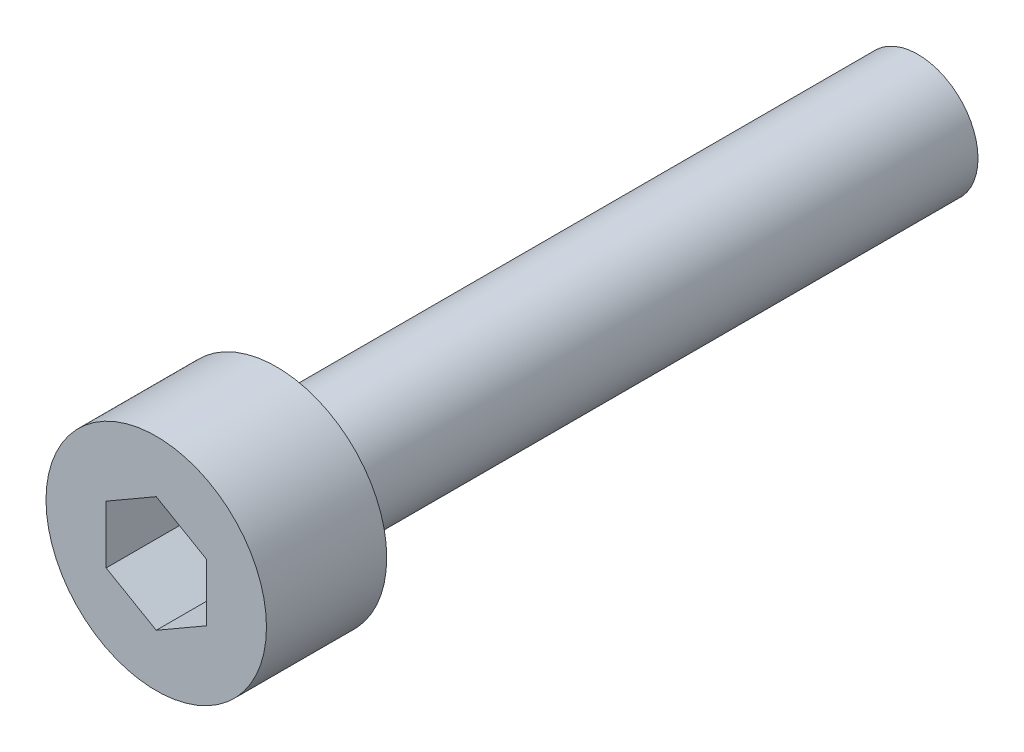
from build123d import *

# Parameters (mm, degrees)
THREAD_ENVELOPE_START = -16
PROFILE_1_R           = 1.5
THREAD_ENVELOPE_DEPTH = 16
PROFILE_2_R           = 2.75
SOCKET_HEAD_DEPTH     = 3


with BuildPart() as part:
    # Profile_1 → Thread_envelope (new body)
    with BuildSketch(Plane.XY.offset(THREAD_ENVELOPE_START)):
        Circle(PROFILE_1_R)
    extrude(amount=THREAD_ENVELOPE_DEPTH)

    # Profile_2 → Socket_head (add)
    with BuildSketch(Plane.XY):
        Circle(PROFILE_2_R)
        Polygon((1.25, 0.721687836), (0, 1.443375673), (-1.25, 0.721687836), (-1.25, -0.721687836), (0, -1.443375673), (1.25, -0.721687836), align=None, mode=Mode.SUBTRACT)
    extrude(amount=SOCKET_HEAD_DEPTH)


solid = part.part
